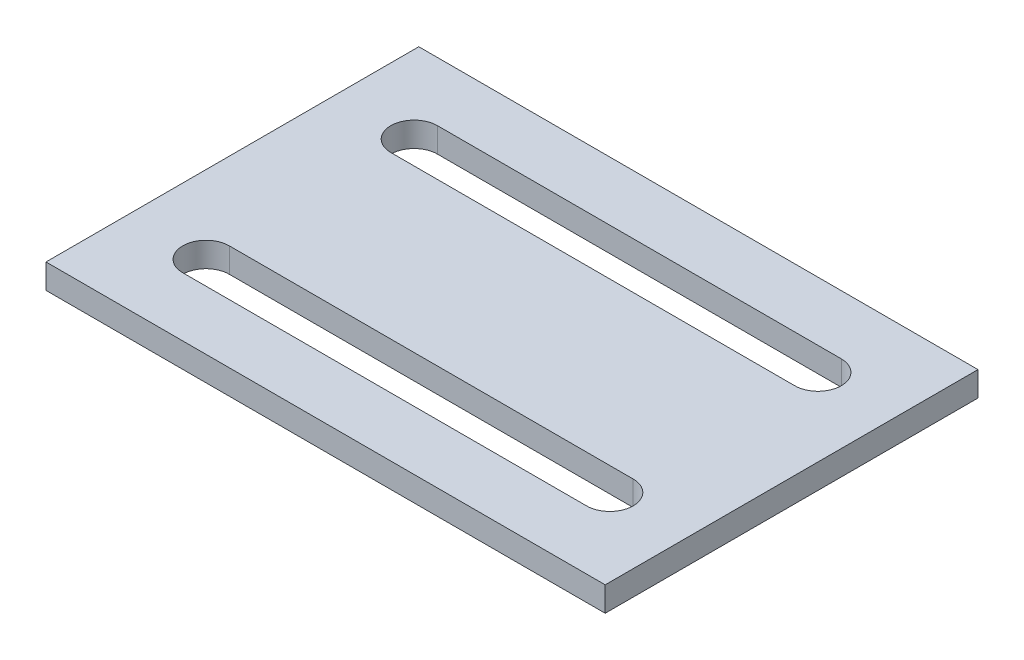
from build123d import *

# Parameters (mm, degrees)
CROQUIS1_W              = 180
CROQUIS1_H              = 120
SALIENTE_EXTRUIR1_DEPTH = 7.9375


with BuildPart() as part:
    # Croquis1 → Saliente-Extruir1 (new body)
    with BuildSketch(Plane(origin=(0, 0, 0), x_dir=(1, 0, 0), z_dir=(0, 1, 0))):
        Rectangle(CROQUIS1_W, CROQUIS1_H)
        with BuildLine():
            Line((-65, -26), (65, -26))
            ThreePointArc((65, -26), (72.5, -33.5), (65, -41))
            Line((65, -41), (-65, -41))
            ThreePointArc((-65, -41), (-72.5, -33.5), (-65, -26))
        make_face(mode=Mode.SUBTRACT)
        with BuildLine():
            Line((-65, 41), (65, 41))
            ThreePointArc((65, 41), (72.5, 33.5), (65, 26))
            Line((65, 26), (-65, 26))
            ThreePointArc((-65, 26), (-72.5, 33.5), (-65, 41))
        make_face(mode=Mode.SUBTRACT)
    extrude(amount=SALIENTE_EXTRUIR1_DEPTH)


solid = part.part
